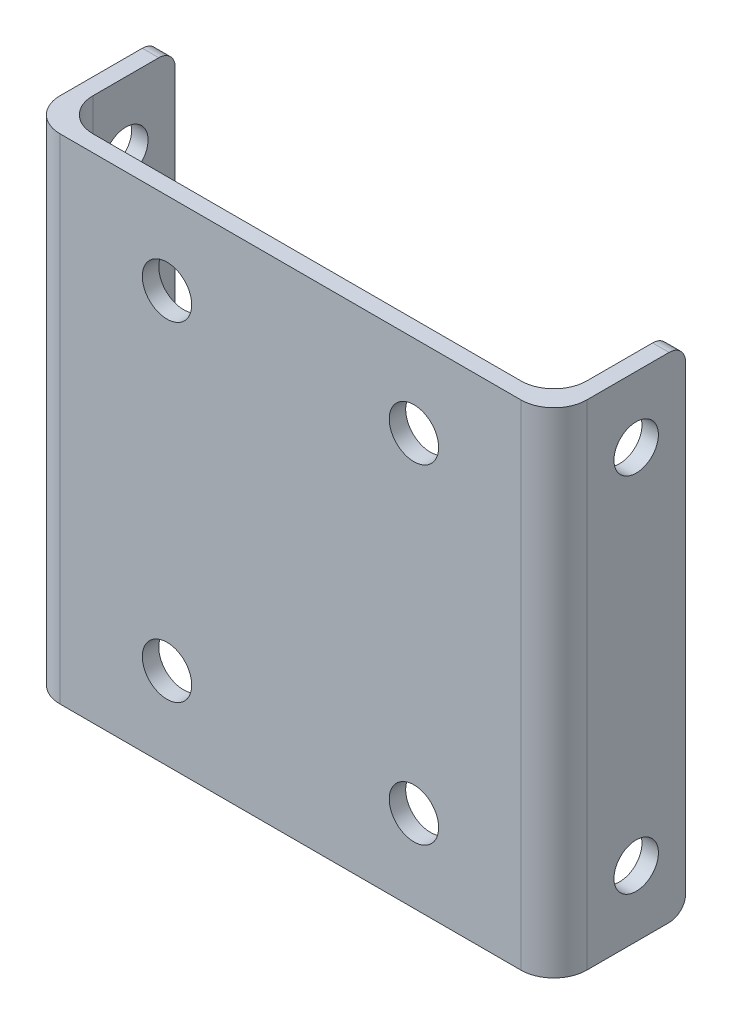
from build123d import *

# Parameters (mm, degrees)
BOSS_EXTRUDE1_DEPTH = 30
FILLET2_R           = 2
SKETCH3_R           = 1.5
CUT_EXTRUDE4_DEPTH  = 39.34383914
SKETCH4_R           = 1.35
CUT_EXTRUDE3_DEPTH  = 45.5
FILLET3_R           = 1


with BuildPart() as part:
    # Sketch1 → Boss-Extrude1 (new body)
    with BuildSketch(Plane(origin=(0, 0, 0), x_dir=(1, 0, 0), z_dir=(0, 1, 0))):
        Polygon((-21.5, 0.5), (8.5, 0.5), (8.5, 7.5), (9.5, 7.5), (9.5, 0.5), (9.5, -0.5), (-22.5, -0.5), (-22.5, 0.5), (-22.5, 7.5), (-21.5, 7.5), align=None)
    extrude(amount=BOSS_EXTRUDE1_DEPTH)

    # Fillet2
    fillet2_edges = [part.edges().sort_by_distance(p)[0] for p in [
        (9.5, 15, 0.5),
        (-22.5, 15, 0.5),
        (-21.5, 15, -0.5),
        (8.5, 15, -0.5),
    ]]
    fillet(fillet2_edges, radius=FILLET2_R)

    # Sketch3 → Cut-Extrude4 (cut, through all)
    with BuildSketch(Plane.XY.offset(0.5)):
        with Locations((-14, 25)):
            Circle(SKETCH3_R)
        with Locations((1, 25)):
            Circle(SKETCH3_R)
        with Locations((-14, 5)):
            Circle(SKETCH3_R)
        with Locations((1, 5)):
            Circle(SKETCH3_R)
    extrude(amount=-CUT_EXTRUDE4_DEPTH, mode=Mode.SUBTRACT)

    # Sketch4 → Cut-Extrude3 (cut, through all)
    with BuildSketch(Plane(origin=(9.5, 0, 0), x_dir=(0, 0, -1), z_dir=(1, 0, 0))):
        with Locations((4.5, 26)):
            Circle(SKETCH4_R)
        with Locations((4.5, 4)):
            Circle(SKETCH4_R)
    extrude(amount=-CUT_EXTRUDE3_DEPTH, mode=Mode.SUBTRACT)

    # Fillet3
    fillet3_edges = [part.edges().sort_by_distance(p)[0] for p in [
        (9, 30, -7.5),
        (-22, 0, -7.5),
        (9, 0, -7.5),
        (-22, 30, -7.5),
    ]]
    fillet(fillet3_edges, radius=FILLET3_R)


solid = part.part
